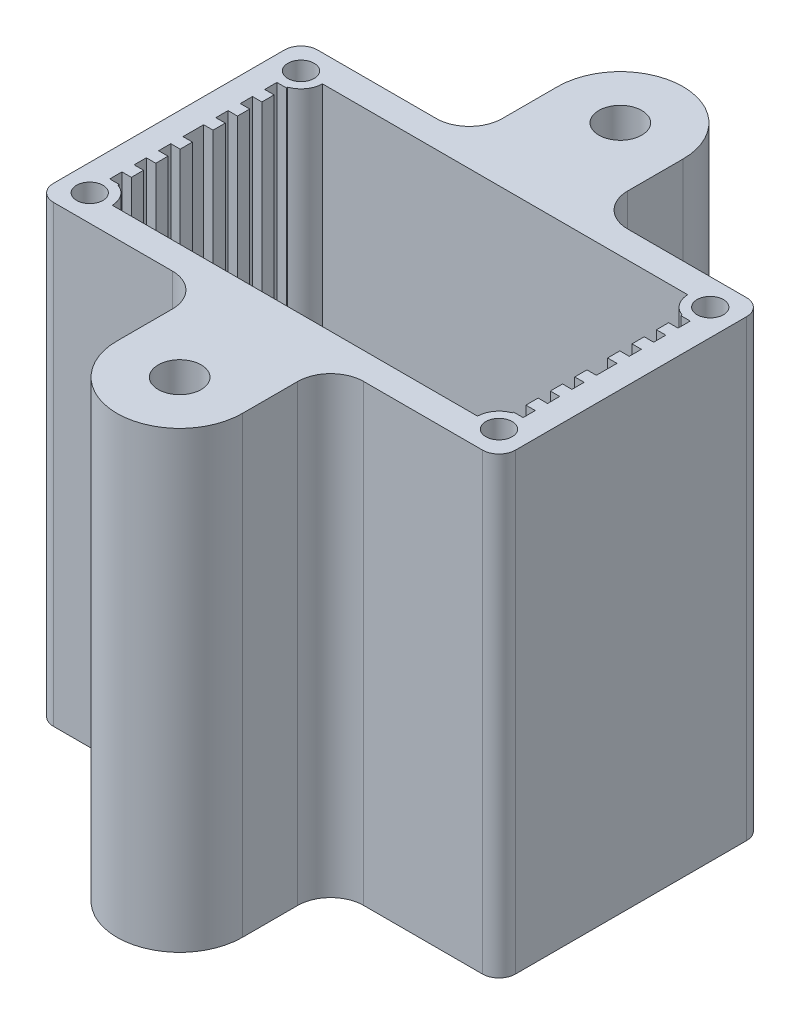
from build123d import *

# Parameters (mm, degrees)
BOSS_EXTRUDE1_DEPTH                        = 69.85
FILLET1_R                                  = 2.54
SKETCH4_R                                  = 3.302
BOSS_EXTRUDE3_DEPTH                        = 69.85
FILLET2_R                                  = 5.08
SKETCH5_R                                  = 3.38963
BOSS_EXTRUDE4_DEPTH                        = 69.85
FILLET1_OF_MIRROR1_R                       = 2.54
FILLET2_OF_MIRROR1_R                       = 5.08
MIRROR2_AT_THE_SECOND_PLANE_COPY_1_SKETC_R = 3.38963
MIRROR2_AT_THE_SECOND_PLANE_COPY_1_DEPTH   = 69.85
SKETCH6_R                                  = 2.032
CUT_EXTRUDE1_DEPTH                         = 90.672163022
MIRROR3_AT_THE_SECOND_PLANE_COPY_1_SKETC_R = 2.032
MIRROR3_AT_THE_SECOND_PLANE_COPY_1_DEPTH   = 90.672163022


with BuildPart() as part:
    # Sketch1 → Boss-Extrude1 (new body)
    with BuildSketch(Plane(origin=(0, 0, 0), x_dir=(1, 0, 0), z_dir=(0, 1, 0))):
        Polygon((30.3657, 16.18107), (-30.3657, 16.18107), (-30.3657, 12.86637), (-31.8135, 12.86637), (-31.8135, 10.98677), (-30.3657, 10.98677), (-30.3657, 9.10717), (-31.8135, 9.10717), (-31.8135, 7.22757), (-30.3657, 7.22757), (-30.3657, 5.34797), (-31.8135, 5.34797), (-31.8135, 3.46837), (-30.3657, 3.46837), (-30.3657, 1.58877), (-31.8135, 1.58877), (-31.8135, 0), (-35.56, 0), (-35.56, 20.32), (35.56, 20.32), (35.56, 0), (31.8135, 0), (31.8135, 1.58877), (30.3657, 1.58877), (30.3657, 3.46837), (31.8135, 3.46837), (31.8135, 5.34797), (30.3657, 5.34797), (30.3657, 7.22757), (31.8135, 7.22757), (31.8135, 9.10717), (30.3657, 9.10717), (30.3657, 10.98677), (31.8135, 10.98677), (31.8135, 12.86637), (30.3657, 12.86637), align=None)
    boss_extrude1 = extrude(amount=BOSS_EXTRUDE1_DEPTH)

    # Fillet1
    fillet1_edges = [part.edges().sort_by_distance(p)[0] for p in [
        (-35.56, 34.925, -20.32),
        (35.56, 34.925, -20.32),
    ]]
    fillet(fillet1_edges, radius=FILLET1_R)

    # Sketch4 → Boss-Extrude3 (add, through all)
    with BuildSketch(Plane(origin=(0, 0, 0), x_dir=(1, 0, 0), z_dir=(0, 1, 0))):
        with BuildLine():
            Line((-9.652, 33.909), (-9.652, 20.32))
            Line((-9.652, 20.32), (9.652, 20.32))
            Line((9.652, 20.32), (9.652, 33.909))
            ThreePointArc((9.652, 33.909), (0, 43.561), (-9.652, 33.909))
        make_face()
        with Locations(Location((0, 33.909, 0), (0, 0, 270))):
            Circle(SKETCH4_R, mode=Mode.SUBTRACT)
    boss_extrude3 = extrude(amount=BOSS_EXTRUDE3_DEPTH)

    # Fillet2
    fillet2_edges = [part.edges().sort_by_distance(p)[0] for p in [
        (-9.652, 34.925, -20.32),
        (9.652, 34.925, -20.32),
    ]]
    fillet(fillet2_edges, radius=FILLET2_R)

    # Sketch5 → Boss-Extrude4 (add)
    with BuildSketch(Plane(origin=(0, 69.85, 0), x_dir=(1, 0, 0), z_dir=(0, 1, 0))):
        with Locations((-31.496, 16.256)):
            Circle(SKETCH5_R)
    boss_extrude4 = extrude(amount=-BOSS_EXTRUDE4_DEPTH)

    # Mirror1: Boss-Extrude1, Boss-Extrude3 across plane
    add(boss_extrude1.mirror(Plane.XY))
    add(boss_extrude3.mirror(Plane.XY))

    # Fillet1 of Mirror1
    fillet1_of_mirror1_edges = [part.edges().sort_by_distance(p)[0] for p in [
        (-35.56, 34.925, 20.32),
        (35.56, 34.925, 20.32),
    ]]
    fillet(fillet1_of_mirror1_edges, radius=FILLET1_OF_MIRROR1_R)

    # Fillet2 of Mirror1
    fillet2_of_mirror1_edges = [part.edges().sort_by_distance(p)[0] for p in [
        (-9.652, 34.925, 20.32),
        (9.652, 34.925, 20.32),
    ]]
    fillet(fillet2_of_mirror1_edges, radius=FILLET2_OF_MIRROR1_R)

    # Mirror2: Boss-Extrude4 across plane
    add(boss_extrude4.mirror(Plane.XY))

    # Mirror2 at the second plane: Boss-Extrude4 across plane
    add(boss_extrude4.mirror(Plane(origin=(0, 0, 0), x_dir=(0, 0, 1), z_dir=(1, 0, 0))))

    # Mirror2 at the second plane copy 1 sketc → Mirror2 at the second plane copy 1 (add)
    with BuildSketch(Plane(origin=(0, 69.85, 0), x_dir=(-1, 0, 0), z_dir=(0, 1, 0))):
        with Locations((-31.496, 16.256)):
            Circle(MIRROR2_AT_THE_SECOND_PLANE_COPY_1_SKETC_R)
    extrude(amount=-MIRROR2_AT_THE_SECOND_PLANE_COPY_1_DEPTH)

    # Sketch6 → Cut-Extrude1 (cut, through all)
    with BuildSketch(Plane(origin=(0, 69.85, 0), x_dir=(1, 0, 0), z_dir=(0, 1, 0))):
        with Locations(Location((-31.496, 16.256, 0), (0, 0, 270))):
            Circle(SKETCH6_R)
    cut_extrude1 = extrude(amount=-CUT_EXTRUDE1_DEPTH, mode=Mode.SUBTRACT)

    # Mirror3: Cut-Extrude1 across plane
    add(cut_extrude1.mirror(Plane.XY), mode=Mode.SUBTRACT)

    # Mirror3 at the second plane: Cut-Extrude1 across plane
    add(cut_extrude1.mirror(Plane(origin=(0, 0, 0), x_dir=(0, 0, 1), z_dir=(1, 0, 0))), mode=Mode.SUBTRACT)

    # Mirror3 at the second plane copy 1 sketc → Mirror3 at the second plane copy 1 (cut, through all)
    with BuildSketch(Plane(origin=(0, 69.85, 0), x_dir=(-1, 0, 0), z_dir=(0, 1, 0))):
        with Locations(Location((-31.496, 16.256, 0), (0, 0, 270))):
            Circle(MIRROR3_AT_THE_SECOND_PLANE_COPY_1_SKETC_R)
    extrude(amount=-MIRROR3_AT_THE_SECOND_PLANE_COPY_1_DEPTH, mode=Mode.SUBTRACT)


solid = part.part
